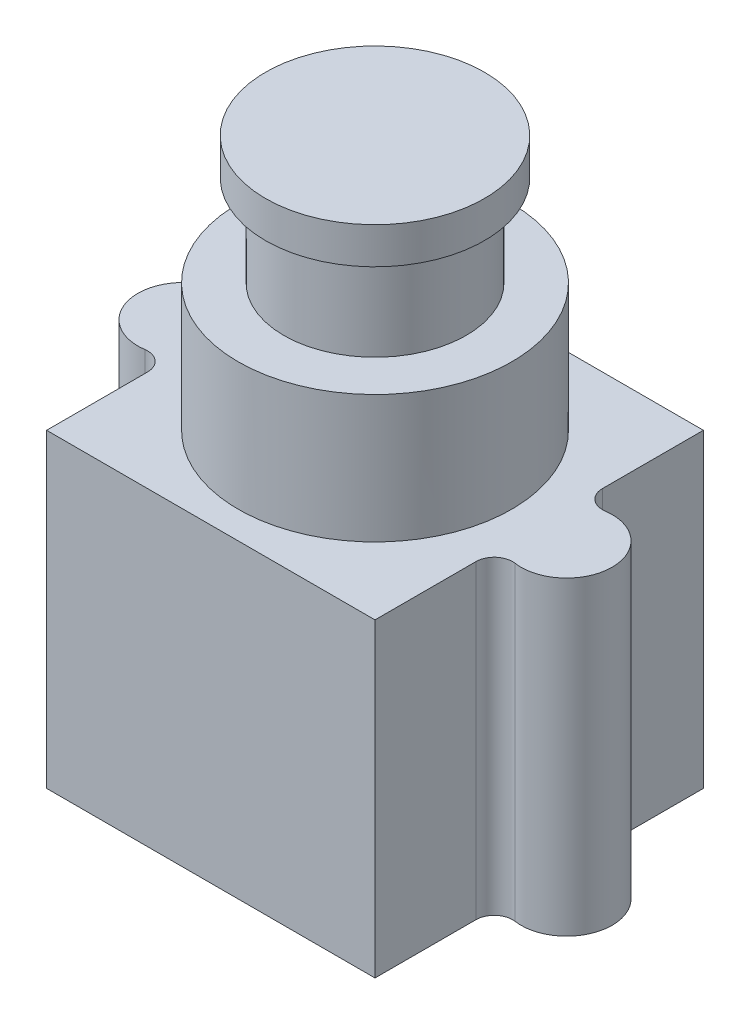
from build123d import *

# Parameters (mm, degrees)
SKETCH1_W           = 18
SKETCH1_H           = 18
BOSS_EXTRUDE1_DEPTH = 17
SKETCH2_R           = 7.5
BOSS_EXTRUDE2_DEPTH = 7
SKETCH3_R           = 5
BOSS_EXTRUDE3_DEPTH = 5
SKETCH4_R           = 6
BOSS_EXTRUDE4_DEPTH = 2
SKETCH5_R           = 2.5
BOSS_EXTRUDE5_DEPTH = 17
FILLET1_R           = 1
SKETCH6_R           = 1.25
CUT_EXTRUDE1_DEPTH  = 6


with BuildPart() as part:
    # Sketch1 → Boss-Extrude1 (new body)
    with BuildSketch(Plane(origin=(0, 0, 0), x_dir=(1, 0, 0), z_dir=(0, 1, 0))):
        Rectangle(SKETCH1_W, SKETCH1_H)
    extrude(amount=BOSS_EXTRUDE1_DEPTH)

    # Sketch2 → Boss-Extrude2 (add)
    with BuildSketch(Plane(origin=(0, 17, 0), x_dir=(1, 0, 0), z_dir=(0, 1, 0))):
        with Locations(Location((0, 0, 0), (0, 0, 90))):
            Circle(SKETCH2_R)
    extrude(amount=BOSS_EXTRUDE2_DEPTH)

    # Sketch3 → Boss-Extrude3 (add)
    with BuildSketch(Plane(origin=(0, 24, 0), x_dir=(1, 0, 0), z_dir=(0, 1, 0))):
        with Locations(Location((0, 0, 0), (0, 0, 270))):
            Circle(SKETCH3_R)
    extrude(amount=BOSS_EXTRUDE3_DEPTH)

    # Sketch4 → Boss-Extrude4 (add)
    with BuildSketch(Plane(origin=(0, 29, 0), x_dir=(1, 0, 0), z_dir=(0, 1, 0))):
        with Locations(Location((0, 0, 0), (0, 0, 270))):
            Circle(SKETCH4_R)
    extrude(amount=BOSS_EXTRUDE4_DEPTH)

    # Sketch5 → Boss-Extrude5 (add)
    with BuildSketch(Plane.XZ):
        with Locations((-10.5, 0)):
            Circle(SKETCH5_R)
        with Locations((10.5, 0)):
            Circle(SKETCH5_R)
    extrude(amount=-BOSS_EXTRUDE5_DEPTH)

    # Fillet1
    fillet1_edges = [part.edges().sort_by_distance(p)[0] for p in [
        (-9, 8.5, 2),
        (-9, 8.5, -2),
        (9, 8.5, -2),
        (9, 8.5, 2),
    ]]
    fillet(fillet1_edges, radius=FILLET1_R)

    # Sketch6 → Cut-Extrude1 (cut)
    with BuildSketch(Plane.XZ):
        with Locations(Location((-10.5, 0, 0), (0, 0, 270))):
            Circle(SKETCH6_R)
        with Locations(Location((10.5, 0, 0), (0, 0, 270))):
            Circle(SKETCH6_R)
    extrude(amount=-CUT_EXTRUDE1_DEPTH, mode=Mode.SUBTRACT)


solid = part.part
